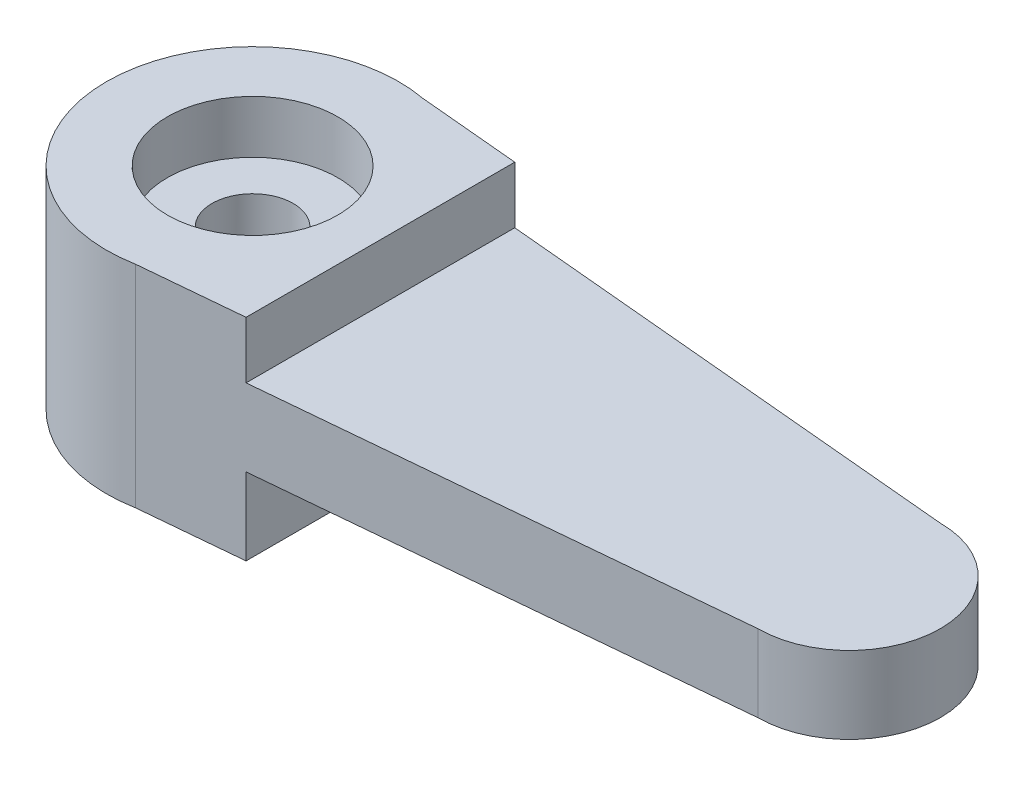
from build123d import *

# Parameters (mm, degrees)
SALIENTE_EXTRUIR2_DEPTH = 2.6
CROQUIS3_R              = 2.1
CORTAR_EXTRUIR1_DEPTH   = 1.3
CROQUIS5_R              = 1
CORTAR_EXTRUIR2_DEPTH   = 5
CORTAR_EXTRUIR3_START   = -2.8
CROQUIS6_R              = 2.1
CORTAR_EXTRUIR3_DEPTH   = 2.8
CROQUIS7_W              = 13.8
CROQUIS7_H              = 1.9
CORTAR_EXTRUIR4_DEPTH   = 5
CROQUIS10_W             = 13.8
CROQUIS10_H             = 2.15
CORTAR_EXTRUIR6_DEPTH   = 5


with BuildPart() as part:
    # Croquis1 → Saliente-Extruir2 (new, symmetric)
    with BuildSketch(Plane(origin=(0, 0, 0), x_dir=(1, 0, 0), z_dir=(0, 1, 0))):
        with BuildLine():
            Line((14.7, 2.25), (0.655694373, 3.53978317))
            ThreePointArc((0.655694373, 3.53978317), (-3.6, 0), (0.655694373, -3.53978317))
            Line((0.655694373, -3.53978317), (14.7, -2.25))
            ThreePointArc((14.7, -2.25), (16.95, 0), (14.7, 2.25))
        make_face()
    extrude(amount=SALIENTE_EXTRUIR2_DEPTH, both=True)

    # Croquis3 → Cortar-Extruir1 (cut)
    with BuildSketch(Plane(origin=(0, 2.6, 0), x_dir=(1, 0, 0), z_dir=(0, 1, 0))):
        with Locations(Location((0, 0, 0), (0, 0, 270))):
            Circle(CROQUIS3_R)
    extrude(amount=-CORTAR_EXTRUIR1_DEPTH, mode=Mode.SUBTRACT)

    # Croquis5 → Cortar-Extruir2 (cut)
    with BuildSketch(Plane(origin=(0, 1.3, 0), x_dir=(1, 0, 0), z_dir=(0, 1, 0))):
        with Locations(Location((0, 0, 0), (0, 0, 270))):
            Circle(CROQUIS5_R)
    extrude(amount=-CORTAR_EXTRUIR2_DEPTH, mode=Mode.SUBTRACT)

    # Croquis6 → Cortar-Extruir3 (cut)
    with BuildSketch(Plane.XZ.offset(2.6).offset(CORTAR_EXTRUIR3_START)):
        with Locations(Location((0, 0, 0), (0, 0, 90))):
            Circle(CROQUIS6_R)
    extrude(amount=CORTAR_EXTRUIR3_DEPTH, mode=Mode.SUBTRACT)

    # Croquis7 → Cortar-Extruir4 (cut, symmetric)
    with BuildSketch(Plane.XY):
        with Locations((10.05, -1.65)):
            Rectangle(CROQUIS7_W, CROQUIS7_H)
    extrude(amount=CORTAR_EXTRUIR4_DEPTH, both=True, mode=Mode.SUBTRACT)

    # Croquis10 → Cortar-Extruir6 (cut, symmetric)
    with BuildSketch(Plane.XY):
        with Locations((10.05, 2.274888949)):
            Rectangle(CROQUIS10_W, CROQUIS10_H)
    extrude(amount=CORTAR_EXTRUIR6_DEPTH, both=True, mode=Mode.SUBTRACT)


solid = part.part
